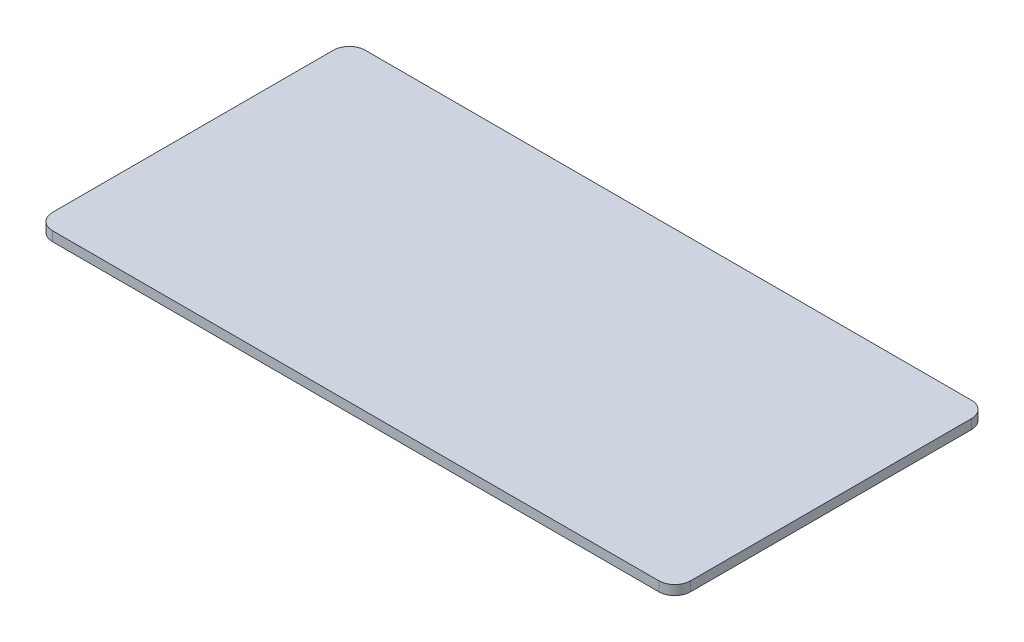
from build123d import *

# Parameters (mm, degrees)
BOSS_EXTRUDE1_DEPTH = 3


with BuildPart() as part:
    # Sketch1 → Boss-Extrude1 (new body)
    with BuildSketch(Plane(origin=(0, 0, 0), x_dir=(1, 0, 0), z_dir=(0, 1, 0))):
        with BuildLine():
            Line((44.450549451, -18.146520147), (-145.549450549, -18.146520147))
            ThreePointArc((-145.549450549, -18.146520147), (-149.084984455, -16.682054052), (-150.549450549, -13.146520147))
            Line((-150.549450549, -13.146520147), (-150.549450549, 74.853479853))
            ThreePointArc((-150.549450549, 74.853479853), (-149.084984455, 78.389013759), (-145.549450549, 79.853479853))
            Line((-145.549450549, 79.853479853), (44.450549451, 79.853479853))
            ThreePointArc((44.450549451, 79.853479853), (47.986083356, 78.389013759), (49.450549451, 74.853479853))
            Line((49.450549451, 74.853479853), (49.450549451, -13.146520147))
            ThreePointArc((49.450549451, -13.146520147), (47.986083356, -16.682054052), (44.450549451, -18.146520147))
        make_face()
    extrude(amount=BOSS_EXTRUDE1_DEPTH)


solid = part.part
